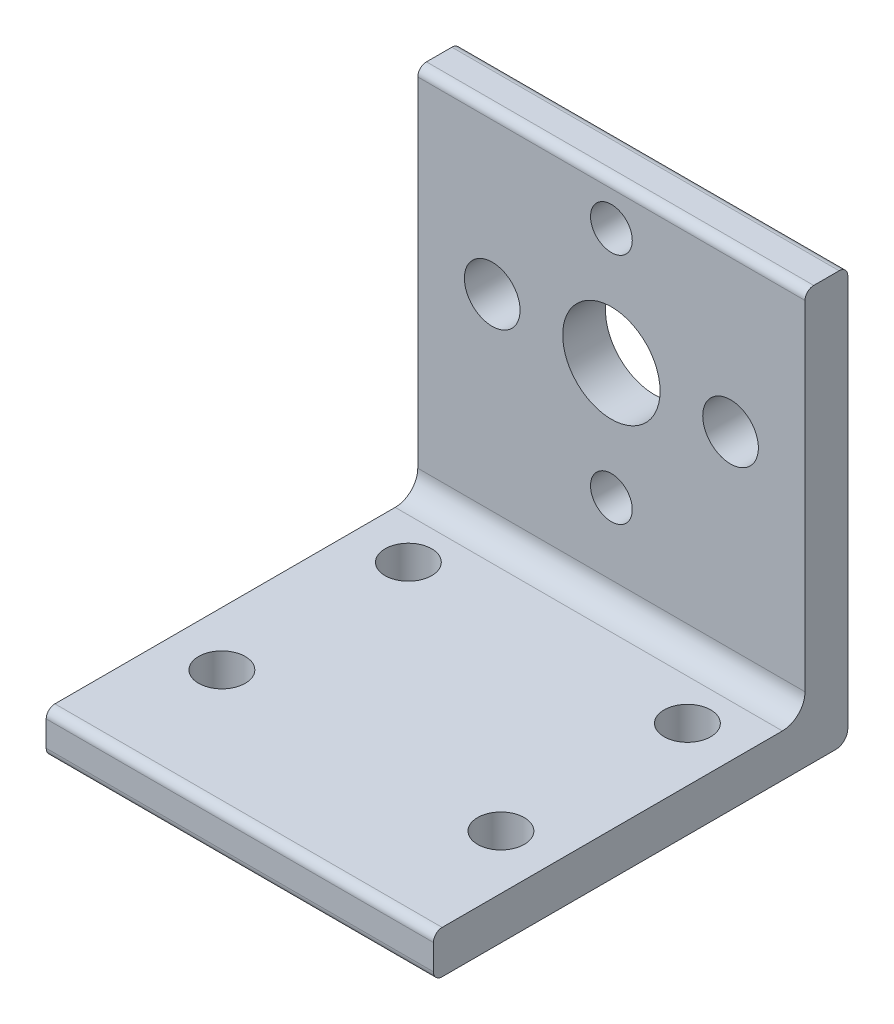
from build123d import *

# Parameters (mm, degrees)
BOSS_EXTRUDE1_DEPTH     = 28.2702
SKETCH2_R               = 3.556
SKETCH2_R_2             = 1.524
SKETCH2_R_3             = 2.032
MOTOR_MOUNT_HOLES_DEPTH = 50.437835996
SKETCH3_R               = 1.7018
PLATE_MOUNT_HOLES_DEPTH = 50.444256141
FILLET1_R               = 1.651
FILLET2_R               = 0.889
FILLET3_R               = 0.635


with BuildPart() as part:
    # Sketch1 → Boss-Extrude1 (new body)
    with BuildSketch(Plane(origin=(0, 0, 0), x_dir=(0, 0, -1), z_dir=(1, 0, 0))):
        Polygon((0, 0), (0, -30.1498), (-30.2514, -30.1498), (-30.2514, -27.0256), (-3.1242, -27.0256), (-3.1242, 0), align=None)
    extrude(amount=BOSS_EXTRUDE1_DEPTH)

    # Sketch2 → Motor_Mount_holes (cut, through all)
    with BuildSketch(Plane.XY.offset(3.1242)):
        with Locations((14.1351, -11.6586)):
            Circle(SKETCH2_R)
        with Locations((14.1351, -3.1496)):
            Circle(SKETCH2_R_2)
        with Locations((5.4356, -11.6586)):
            Circle(SKETCH2_R_3)
        with Locations(Location((22.8346, -11.6586, 0), (0, 0, 180))):
            Circle(SKETCH2_R_3)
        with Locations(Location((14.1351, -20.1676, 0), (0, 0, 180))):
            Circle(SKETCH2_R_2)
    extrude(amount=-MOTOR_MOUNT_HOLES_DEPTH, mode=Mode.SUBTRACT)

    # Sketch3 → Plate_Mount_Holes (cut, through all)
    with BuildSketch(Plane(origin=(0, -27.0256, 0), x_dir=(1, 0, 0), z_dir=(0, 1, 0))):
        with Locations(Location((24.3205, -7.7597, 0), (0, 0, 270))):
            Circle(SKETCH3_R)
        with Locations(Location((3.9497, -7.7597, 0), (0, 0, 270))):
            Circle(SKETCH3_R)
        with Locations(Location((3.9497, -21.3741, 0), (0, 0, 270))):
            Circle(SKETCH3_R)
        with Locations(Location((24.3205, -21.3741, 0), (0, 0, 270))):
            Circle(SKETCH3_R)
    extrude(amount=-PLATE_MOUNT_HOLES_DEPTH, mode=Mode.SUBTRACT)

    # Fillet1
    fillet1_edges = [part.edges().sort_by_distance(p)[0] for p in [
        (14.1351, -27.0256, 3.1242),
    ]]
    fillet(fillet1_edges, radius=FILLET1_R)

    # Fillet2
    fillet2_edges = [part.edges().sort_by_distance(p)[0] for p in [
        (14.1351, -30.1498, 0),
    ]]
    fillet(fillet2_edges, radius=FILLET2_R)

    # Fillet3
    fillet3_edges = [part.edges().sort_by_distance(p)[0] for p in [
        (14.1351, 0, 0),
        (14.1351, -30.1498, 30.2514),
        (14.1351, -27.0256, 30.2514),
        (14.1351, 0, 3.1242),
    ]]
    fillet(fillet3_edges, radius=FILLET3_R)


solid = part.part
